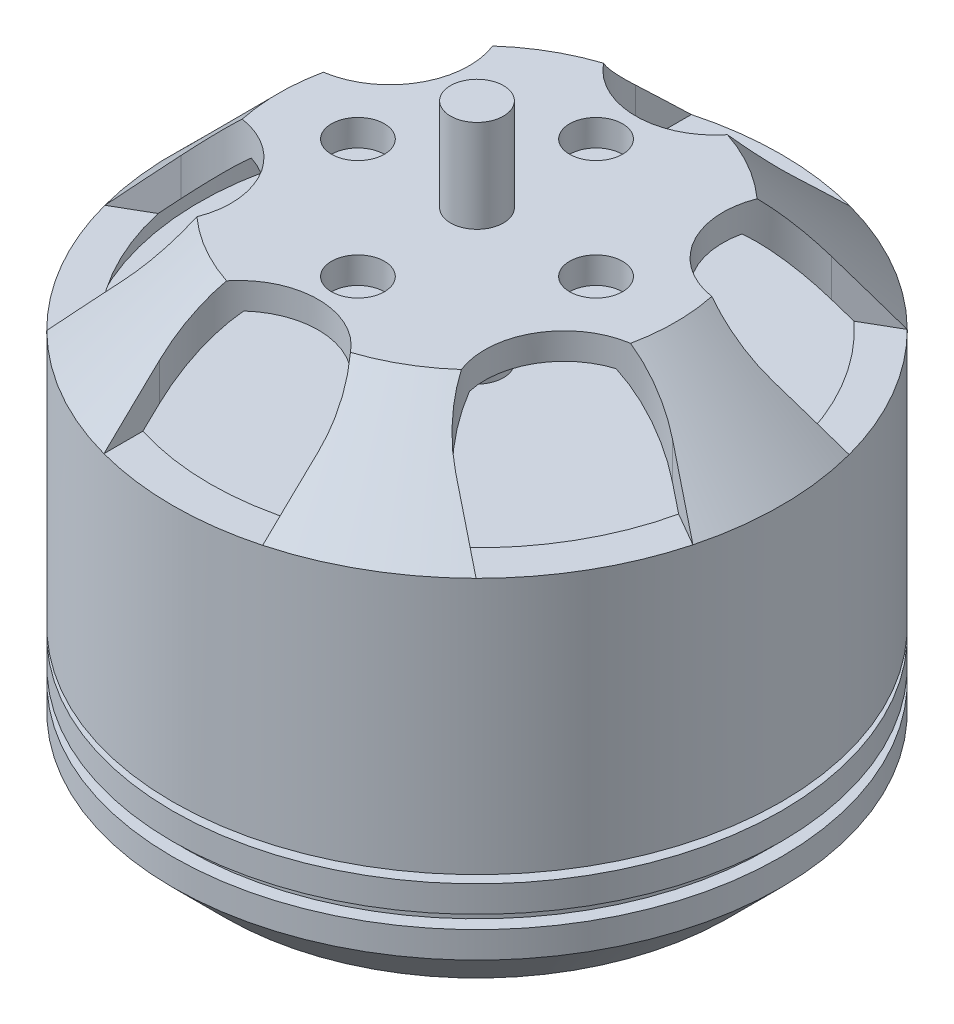
from build123d import *

# Parameters (mm, degrees)
SKETCH2_R          = 1
CUT_EXTRUDE1_DEPTH = 4
SKETCH3_R          = 1
CUT_EXTRUDE2_DEPTH = 3


with BuildPart() as part:
    # Sketch1 → Revolve1 (revolve)
    with BuildSketch(Plane.XY, mode=Mode.PRIVATE) as revolve1_sk:
        Polygon((0, 21.153806929), (0, 0), (0, -2.646193071), (1, -2.646193071), (1, -0.846193071), (9.5, -0.846193071), (11.5, 1.153806929), (11.5, 2.153806929), (11, 2.153806929), (11, 2.653806929), (11.5, 2.653806929), (11.5, 3.653806929), (9.5, 3.653806929), (9.5, 3.953806929), (11.5, 3.953806929), (11.5, 13.653806929), (7.5, 17.653806929), (1, 17.653806929), (1, 21.153806929), align=None)
        Polygon((2, 16.653806929), (7.085786438, 16.653806929), (10.5, 13.239593367), (10.5, 12.586902367), (1, 12.586902367), (1, 15.653806929), (2, 15.653806929), align=None, mode=Mode.SUBTRACT)
    revolve(revolve1_sk.sketch.rotate(Axis((0, 21.153806929, 0), (0, -1, 0)), 90), axis=Axis((0, 21.153806929, 0), (0, -1, 0)))

    # Sketch2 → Cut-Extrude1 (cut)
    with BuildSketch(Plane(origin=(0, 17.653806929, 0), x_dir=(1, 0, 0), z_dir=(0, 1, 0))):
        with Locations(Location((0, -4.5, 0), (0, 0, 270))):
            Circle(SKETCH2_R)
        with Locations(Location((-4.5, 0, 0), (0, 0, 270))):
            Circle(SKETCH2_R)
        with Locations(Location((0, 4.5, 0), (0, 0, 270))):
            Circle(SKETCH2_R)
        with Locations(Location((4.5, 0, 0), (0, 0, 270))):
            Circle(SKETCH2_R)
        with BuildLine():
            Line((-3, 9), (-3, 16.489016336))
            Line((-3, 16.489016336), (3, 16.489016336))
            Line((3, 16.489016336), (3, 9))
            ThreePointArc((3, 9), (0, 6), (-3, 9))
        make_face()
        with BuildLine():
            Line((15.779907031, 5.646431957), (9.294228634, 1.901923789))
            ThreePointArc((9.294228634, 1.901923789), (5.196152423, 3), (6.294228634, 7.098076211))
            Line((6.294228634, 7.098076211), (12.779907031, 10.842584379))
            Line((12.779907031, 10.842584379), (15.779907031, 5.646431957))
        make_face()
        with BuildLine():
            Line((12.779907031, -10.842584379), (6.294228634, -7.098076211))
            ThreePointArc((6.294228634, -7.098076211), (5.196152423, -3), (9.294228634, -1.901923789))
            Line((9.294228634, -1.901923789), (15.779907031, -5.646431957))
            Line((15.779907031, -5.646431957), (12.779907031, -10.842584379))
        make_face()
        with BuildLine():
            Line((-3, -16.489016336), (-3, -9))
            ThreePointArc((-3, -9), (0, -6), (3, -9))
            Line((3, -9), (3, -16.489016336))
            Line((3, -16.489016336), (-3, -16.489016336))
        make_face()
        with BuildLine():
            Line((-15.779907031, -5.646431957), (-9.294228634, -1.901923789))
            ThreePointArc((-9.294228634, -1.901923789), (-5.196152423, -3), (-6.294228634, -7.098076211))
            Line((-6.294228634, -7.098076211), (-12.779907031, -10.842584379))
            Line((-12.779907031, -10.842584379), (-15.779907031, -5.646431957))
        make_face()
        with BuildLine():
            Line((-12.779907031, 10.842584379), (-6.294228634, 7.098076211))
            ThreePointArc((-6.294228634, 7.098076211), (-5.196152423, 3), (-9.294228634, 1.901923789))
            Line((-9.294228634, 1.901923789), (-15.779907031, 5.646431957))
            Line((-15.779907031, 5.646431957), (-12.779907031, 10.842584379))
        make_face()
    extrude(amount=-CUT_EXTRUDE1_DEPTH, mode=Mode.SUBTRACT)

    # Sketch3 → Cut-Extrude2 (cut)
    with BuildSketch(Plane.XZ.offset(0.846193071)):
        with Locations(Location((0, 6, 0), (0, 0, 270))):
            Circle(SKETCH3_R)
        with Locations(Location((0, -6, 0), (0, 0, 270))):
            Circle(SKETCH3_R)
        with Locations(Location((-8, 0, 0), (0, 0, 270))):
            Circle(SKETCH3_R)
        with Locations(Location((8, 0, 0), (0, 0, 270))):
            Circle(SKETCH3_R)
    extrude(amount=-CUT_EXTRUDE2_DEPTH, mode=Mode.SUBTRACT)


solid = part.part
